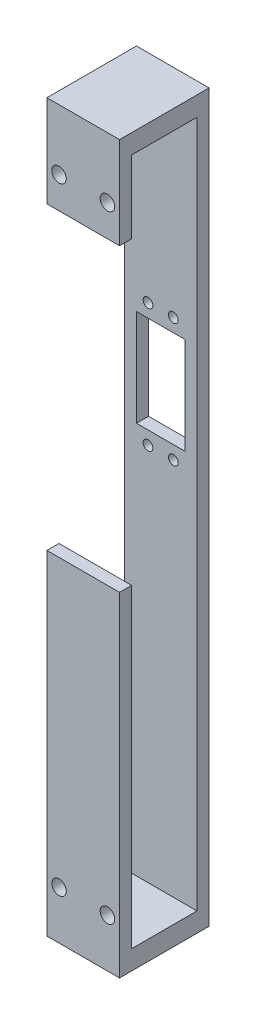
from build123d import *

# Parameters (mm, degrees)
SKETCH_2_W          = 30
SKETCH_2_H          = 60
SKETCH_2_W_2        = 20
SKETCH_2_H_2        = 40
EXTRUDE_1_DEPTH     = 5
SKETCH_3_R          = 2
CUT_EXTRUDE_1_DEPTH = 5
EXTRUDE_2_DEPTH     = 5
SKETCH_6_R          = 1.5
CUT_EXTRUDE_2_DEPTH = 5
SKETCH_7_W          = 5
SKETCH_7_H          = 10
CUT_EXTRUDE_3_DEPTH = 100
SKETCH_8_W          = 30
SKETCH_8_H          = 5
EXTRUDE_3_DEPTH     = 80
SKETCH_9_W          = 30
SKETCH_9_H          = 5
EXTRUDE_4_DEPTH     = 60
SKETCH_11_W         = 30
SKETCH_11_H         = 8
EXTRUDE_5_DEPTH     = 32
EXTRUDE_6_DEPTH     = 30
SKETCH_14_W         = 30
SKETCH_14_H         = 5
EXTRUDE_7_DEPTH     = 30
SKETCH_15_W         = 37
SKETCH_15_H         = 100
EXTRUDE_8_DEPTH     = 30
SKETCH_12_R         = 3
CUT_EXTRUDE_5_DEPTH = 50
SKETCH_16_W         = 27
SKETCH_16_H         = 100
CUT_EXTRUDE_6_DEPTH = 30
SKETCH_17_R         = 3
CUT_EXTRUDE_7_DEPTH = 30


with BuildPart() as part:
    # 草图2 → 凸台-拉伸1 (new body)
    with BuildSketch(Plane.XY):
        with Locations((10, -20)):
            Rectangle(SKETCH_2_W, SKETCH_2_H)
        with Locations((10, -20)):
            Rectangle(SKETCH_2_W_2, SKETCH_2_H_2, mode=Mode.SUBTRACT)
    extrude(amount=EXTRUDE_1_DEPTH)

    # 草图3 → 切除-拉伸1 (cut)
    with BuildSketch(Plane.XY.offset(5)):
        with Locations((15.25, 5.5)):
            Circle(SKETCH_3_R)
        with Locations((15.25, -45.5)):
            Circle(SKETCH_3_R)
        with Locations((4.75, -45.5)):
            Circle(SKETCH_3_R)
        with Locations((4.75, 5.5)):
            Circle(SKETCH_3_R)
    extrude(amount=-CUT_EXTRUDE_1_DEPTH, mode=Mode.SUBTRACT)

    # 草图5 → 凸台-拉伸2 (add)
    with BuildSketch(Plane(origin=(25, 0, 0), x_dir=(0, 0, -1), z_dir=(1, 0, 0))):
        with BuildLine():
            Line((-5, -42), (-5, -40))
            Line((-5, -40), (0, -40))
            Line((0, -40), (0, -42))
            ThreePointArc((0, -42), (0.878679656, -44.121320344), (3, -45))
            Line((3, -45), (20, -45))
            Line((20, -45), (20, -50))
            Line((20, -50), (0, -50))
            Line((0, -50), (-5, -50))
            Line((-5, -50), (-25, -50))
            Line((-25, -50), (-25, -45))
            Line((-25, -45), (-8, -45))
            ThreePointArc((-8, -45), (-5.878679656, -44.121320344), (-5, -42))
        make_face()
    extrude_2 = extrude(amount=EXTRUDE_2_DEPTH)

    # 镜向1: 凸台-拉伸2 across plane
    add(extrude_2.mirror(Plane(origin=(10, 0, 0), x_dir=(0, 0, 1), z_dir=(1, 0, 0))))

    # 草图6 → 切除-拉伸2 (cut)
    with BuildSketch(Plane(origin=(0, -45, 0), x_dir=(1, 0, 0), z_dir=(0, 1, 0))):
        with Locations(Location((-7.5, 12.5, 0), (0, 0, 270))):
            Circle(SKETCH_6_R)
        with Locations(Location((-7.5, -17.5, 0), (0, 0, 270))):
            Circle(SKETCH_6_R)
        with Locations(Location((27.5, -17.5, 0), (0, 0, 270))):
            Circle(SKETCH_6_R)
        with Locations(Location((27.5, 12.5, 0), (0, 0, 270))):
            Circle(SKETCH_6_R)
    extrude(amount=-CUT_EXTRUDE_2_DEPTH, mode=Mode.SUBTRACT)

    # 草图7 → 切除-拉伸3 (cut)
    with BuildSketch(Plane.XY.offset(25)):
        with Locations((27.5, -45)):
            Rectangle(SKETCH_7_W, SKETCH_7_H)
        with Locations((-7.5, -45)):
            Rectangle(SKETCH_7_W, SKETCH_7_H)
    extrude(amount=-CUT_EXTRUDE_3_DEPTH, mode=Mode.SUBTRACT)

    # 草图8 → 凸台-拉伸3 (add)
    with BuildSketch(Plane(origin=(0, 10, 0), x_dir=(1, 0, 0), z_dir=(0, 1, 0))):
        with Locations((10, -2.5)):
            Rectangle(SKETCH_8_W, SKETCH_8_H)
    extrude(amount=EXTRUDE_3_DEPTH)

    # 草图9 → 凸台-拉伸4 (add)
    with BuildSketch(Plane.XZ.offset(50)):
        with Locations((10, 2.5)):
            Rectangle(SKETCH_9_W, SKETCH_9_H)
    extrude(amount=EXTRUDE_4_DEPTH)

    # 草图11 → 凸台-拉伸5 (add)
    with BuildSketch(Plane.XY.offset(5)):
        with Locations((10, -106)):
            Rectangle(SKETCH_11_W, SKETCH_11_H)
        with Locations((10, 86)):
            Rectangle(SKETCH_11_W, SKETCH_11_H)
    extrude(amount=EXTRUDE_5_DEPTH)

    # 草图13 → 凸台-拉伸6 (add)
    with BuildSketch(Plane(origin=(0, -102, 0), x_dir=(1, 0, 0), z_dir=(0, 1, 0))):
        Polygon((-5, -37), (25, -37), (25, -34.408335309), (25, -32), (-5, -32), align=None)
    extrude(amount=EXTRUDE_6_DEPTH)

    # 草图14 → 凸台-拉伸7 (add)
    with BuildSketch(Plane.XZ.offset(-82)):
        with Locations((10, 34.5)):
            Rectangle(SKETCH_14_W, SKETCH_14_H)
    extrude(amount=EXTRUDE_7_DEPTH)

    # 草图15 → 凸台-拉伸8 (add)
    with BuildSketch(Plane.ZY.offset(5)):
        with Locations((18.5, -160)):
            Rectangle(SKETCH_15_W, SKETCH_15_H)
    extrude(amount=-EXTRUDE_8_DEPTH)

    # 草图12 → 切除-拉伸5 (cut)
    with BuildSketch(Plane.XY.offset(5)):
        with Locations((0, 65)):
            Circle(SKETCH_12_R)
        with Locations((20, 65)):
            Circle(SKETCH_12_R)
    extrude(amount=CUT_EXTRUDE_5_DEPTH, mode=Mode.SUBTRACT)

    # 草图16 → 切除-拉伸6 (cut)
    with BuildSketch(Plane(origin=(25, 0, 0), x_dir=(0, 0, -1), z_dir=(1, 0, 0))):
        with Locations((-18.5, -152)):
            Rectangle(SKETCH_16_W, SKETCH_16_H)
    extrude(amount=-CUT_EXTRUDE_6_DEPTH, mode=Mode.SUBTRACT)

    # 草图17 → 切除-拉伸7 (cut)
    with BuildSketch(Plane.XY.offset(37)):
        with Locations((20, -190)):
            Circle(SKETCH_17_R)
        with Locations((0, -190)):
            Circle(SKETCH_17_R)
    extrude(amount=-CUT_EXTRUDE_7_DEPTH, mode=Mode.SUBTRACT)


solid = part.part
